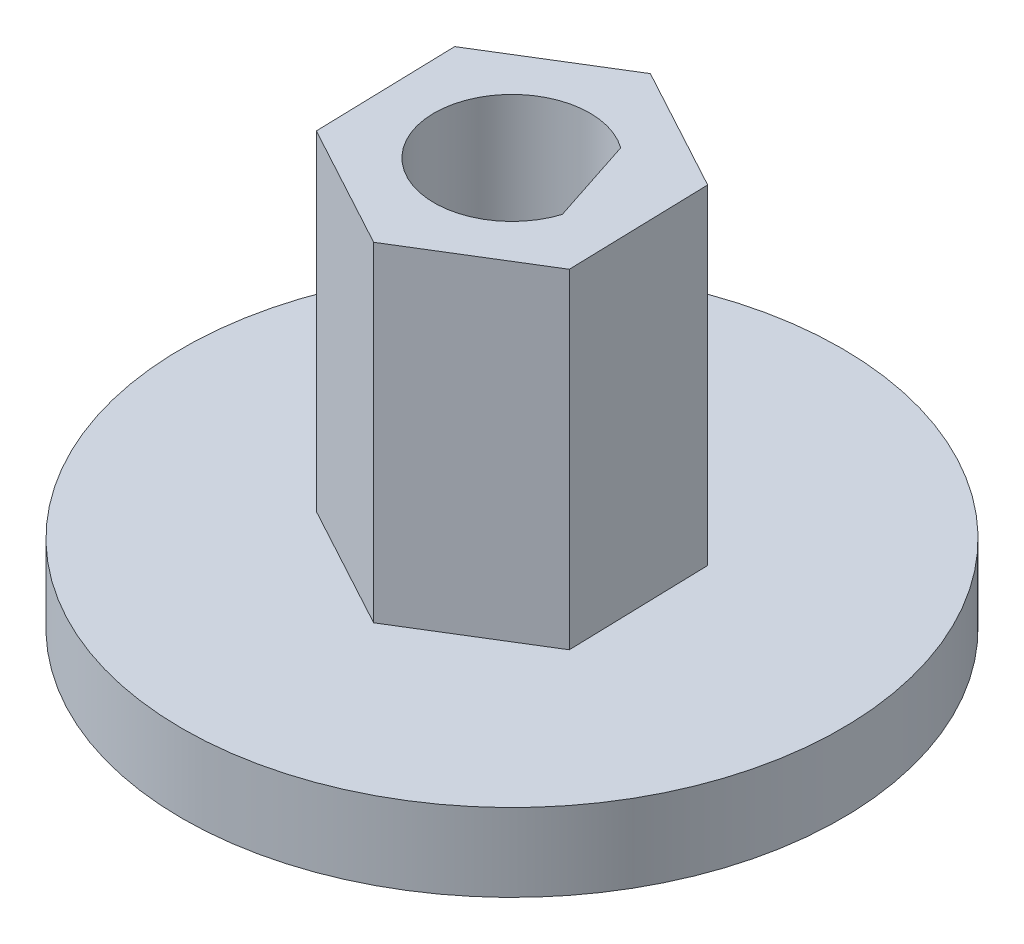
from build123d import *

# Parameters (mm, degrees)
SKETCH1_R           = 12.7
BOSS_EXTRUDE1_DEPTH = 3
BOSS_EXTRUDE2_DEPTH = 12.7
CUT_EXTRUDE1_DEPTH  = 23


with BuildPart() as part:
    # Sketch1 → Boss-Extrude1 (new body)
    with BuildSketch(Plane(origin=(0, 0, 0), x_dir=(1, 0, 0), z_dir=(0, 1, 0))):
        with Locations(Location((0, 0, 0), (0, 0, 270))):
            Circle(SKETCH1_R)
    extrude(amount=BOSS_EXTRUDE1_DEPTH)

    # Sketch2 → Boss-Extrude2 (add)
    with BuildSketch(Plane(origin=(0, 3, 0), x_dir=(1, 0, 0), z_dir=(0, 1, 0))):
        Polygon((0.148889151, -5.48), (4.820263788, -2.611058213), (4.671374637, 2.868941787), (-0.148889151, 5.48), (-4.820263788, 2.611058213), (-4.671374637, -2.868941787), align=None)
    extrude(amount=BOSS_EXTRUDE2_DEPTH)

    # Sketch6 → Cut-Extrude1 (cut)
    with BuildSketch(Plane(origin=(0, 15.7, 0), x_dir=(1, 0, 0), z_dir=(0, 1, 0))):
        with BuildLine():
            Line((2.855757074, -0.919049257), (1.757975678, 2.430950743))
            ThreePointArc((1.757975678, 2.430950743), (-2.850834523, -0.934206895), (2.855757074, -0.919049257))
        make_face()
    extrude(amount=-CUT_EXTRUDE1_DEPTH, mode=Mode.SUBTRACT)


solid = part.part
